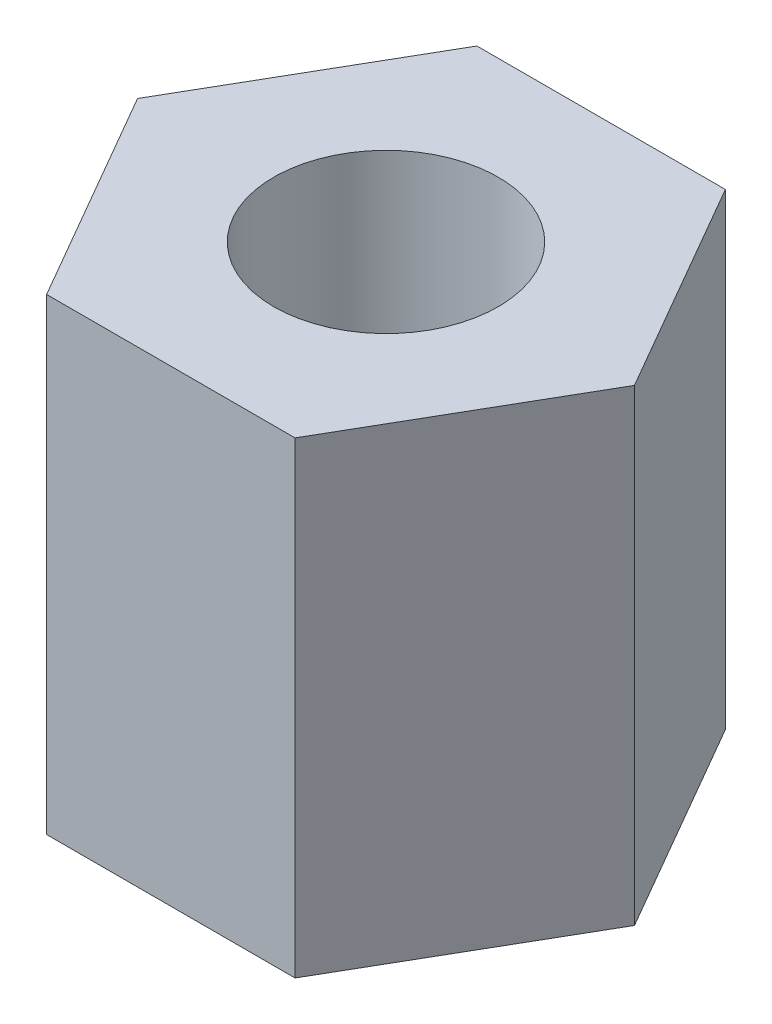
from build123d import *

# Parameters (mm, degrees)
SKETCH_1_R      = 1.2
EXTRUDE_1_DEPTH = 5


with BuildPart() as part:
    # 草图1 → 凸台-拉伸1 (new body)
    with BuildSketch(Plane(origin=(0, 0, 0), x_dir=(1, 0, 0), z_dir=(0, 1, 0))):
        Polygon((2.655811238, 0), (1.327905619, 2.3), (-1.327905619, 2.3), (-2.655811238, 0), (-1.327905619, -2.3), (1.327905619, -2.3), align=None)
        with Locations(Location((0, 0, 0), (0, 0, 270))):
            Circle(SKETCH_1_R, mode=Mode.SUBTRACT)
    extrude(amount=EXTRUDE_1_DEPTH)


solid = part.part
